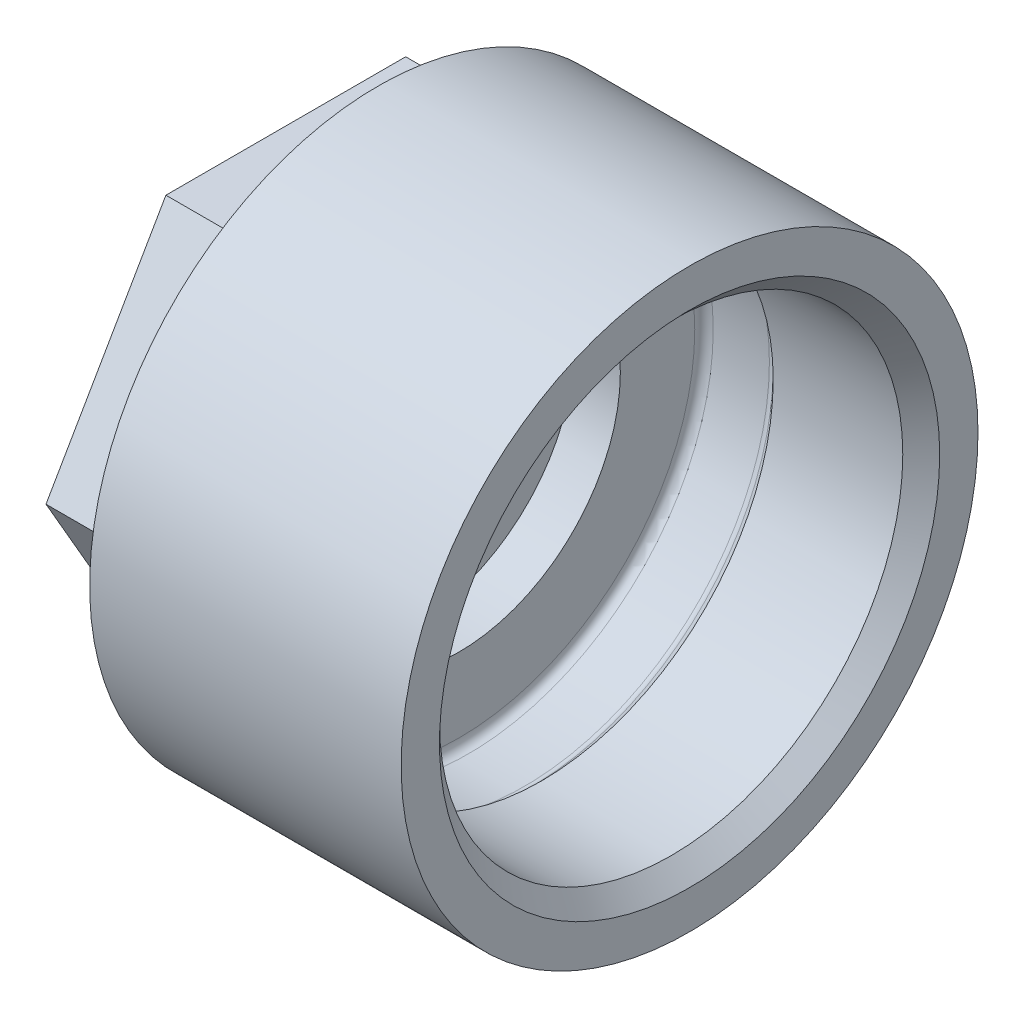
from build123d import *

# Parameters (mm, degrees)
SKETCH_4_OUTSIDE_W  = 67.78
SKETCH_4_OUTSIDE_H  = 67.78
CUT_EXTRUDE_1_DEPTH = 7


with BuildPart() as part:
    # Эскиз1 → Повернуть1 (revolve)
    with BuildSketch(Plane.XY, mode=Mode.PRIVATE) as revolve_1_sk:
        with BuildLine():
            Line((0, 21.68), (0, 25))
            Line((0, 25), (-27, 25))
            Line((-27, 25), (-27, 21))
            Line((-27, 21), (-35, 21))
            Line((-35, 21), (-35, 2))
            Line((-35, 2), (-24, 2))
            Line((-24, 2), (-24, 14))
            Line((-24, 14), (-20, 14))
            Line((-20, 14), (-20, 20.45))
            ThreePointArc((-20, 20.45), (-19.765685425, 21.015685425), (-19.2, 21.25))
            Line((-19.2, 21.25), (-14.33137085, 21.25))
            ThreePointArc((-14.33137085, 21.25), (-14.025224104, 21.189103626), (-13.765685425, 21.015685425))
            Line((-13.765685425, 21.015685425), (-12.83, 20.08))
            Line((-12.83, 20.08), (-1.6, 20.08))
            Line((-1.6, 20.08), (0, 21.68))
        make_face()
    revolve(revolve_1_sk.sketch.rotate(Axis((0, 0, 0), (-1, 0, 0)), 90), axis=Axis((0, 0, 0), (-1, 0, 0)))

    # Эскиз4 outside → Вырез-Вытянуть1 (cut)
    with BuildSketch(Plane.ZY.offset(35)):
        Rectangle(SKETCH_4_OUTSIDE_W, SKETCH_4_OUTSIDE_H)
        Polygon((20.784609691, 0), (10.392304845, 18), (-10.392304845, 18), (-20.784609691, 0), (-10.392304845, -18), (10.392304845, -18), align=None, mode=Mode.SUBTRACT)
    extrude(amount=-CUT_EXTRUDE_1_DEPTH, mode=Mode.SUBTRACT)


solid = part.part
